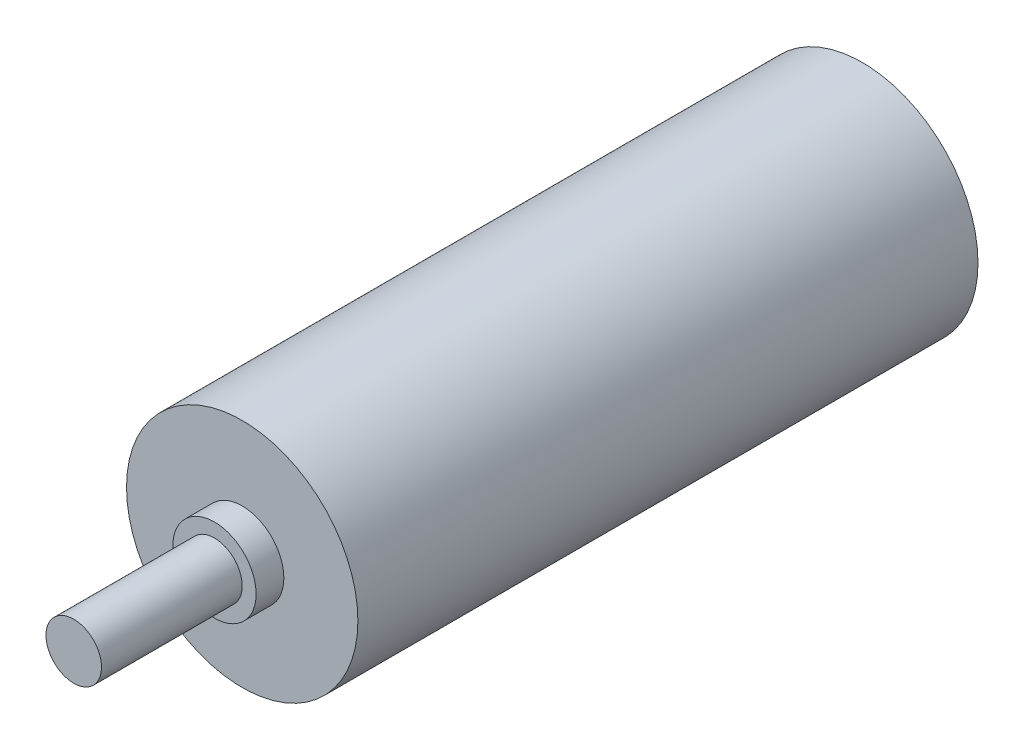
from build123d import *

# Parameters (mm, degrees)
SKETCH1_R           = 12.5
BOSS_EXTRUDE1_DEPTH = 67
SKETCH2_R           = 4.5
BOSS_EXTRUDE3_DEPTH = 3
SKETCH3_R           = 3
BOSS_EXTRUDE4_DEPTH = 15.2


with BuildPart() as part:
    # Sketch1 → Boss-Extrude1 (new body)
    with BuildSketch(Plane.XY):
        Circle(SKETCH1_R)
    extrude(amount=BOSS_EXTRUDE1_DEPTH)

    # Sketch2 → Boss-Extrude3 (add)
    with BuildSketch(Plane.XY.offset(67)):
        Circle(SKETCH2_R)
    extrude(amount=BOSS_EXTRUDE3_DEPTH)

    # Sketch3 → Boss-Extrude4 (add)
    with BuildSketch(Plane.XY.offset(70)):
        with Locations(Location((0, 0, 0), (0, 0, 180))):
            Circle(SKETCH3_R)
    extrude(amount=BOSS_EXTRUDE4_DEPTH)


solid = part.part
